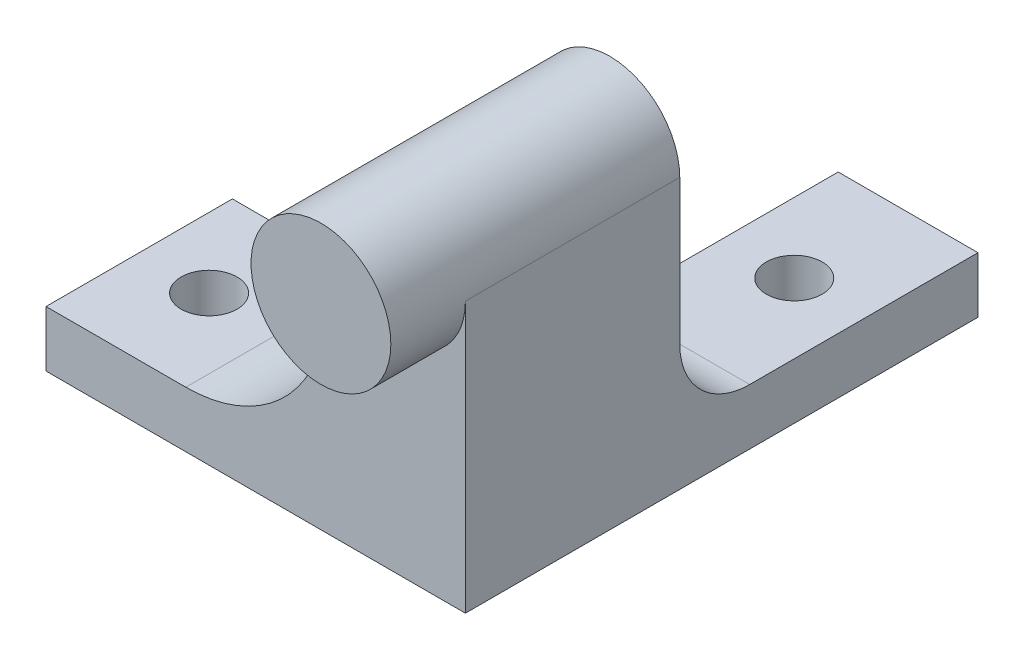
from build123d import *

# Parameters (mm, degrees)
BOSS_EXTRUDE1_DEPTH = 20
SKETCH3_R           = 7.5
BOSS_EXTRUDE3_DEPTH = 8
BOSS_EXTRUDE4_DEPTH = 15
BOSS_EXTRUDE5_START = 3
SKETCH5_R           = 7.5
BOSS_EXTRUDE5_DEPTH = 3
SKETCH6_R           = 3
CUT_EXTRUDE1_DEPTH  = 60.678304265


with BuildPart() as part:
    # Sketch1 → Boss-Extrude1 (new body)
    with BuildSketch(Plane.XY):
        with BuildLine():
            Line((-7.5, 0), (-7.5, -8))
            ThreePointArc((-7.5, -8), (-11.893398282, -18.606601718), (-22.5, -23))
            Line((-22.5, -23), (-37.5, -23))
            Line((-37.5, -23), (-37.5, -29))
            Line((-37.5, -29), (7.5, -29))
            Line((7.5, -29), (7.5, -23))
            Line((7.5, -23), (7.5, -8))
            Line((7.5, -8), (7.5, 0))
            ThreePointArc((7.5, 0), (0, 7.5), (-7.5, 0))
        make_face()
    extrude(amount=BOSS_EXTRUDE1_DEPTH)

    # Sketch3 → Boss-Extrude3 (add)
    with BuildSketch(Plane.XY.offset(20)):
        Circle(SKETCH3_R)
    extrude(amount=BOSS_EXTRUDE3_DEPTH)

    # Sketch4 → Boss-Extrude4 (add)
    with BuildSketch(Plane(origin=(7.5, 0, 0), x_dir=(0, 0, -1), z_dir=(1, 0, 0))):
        with BuildLine():
            Line((0, -29), (35, -29))
            Line((35, -29), (35, -23))
            Line((35, -23), (10.5, -23))
            ThreePointArc((10.5, -23), (5.196699141, -20.803300859), (3, -15.5))
            Line((3, -15.5), (3, 0))
            Line((3, 0), (0, 0))
            Line((0, 0), (0, -29))
        make_face()
    extrude(amount=-BOSS_EXTRUDE4_DEPTH)

    # Sketch5 → Boss-Extrude5 (add)
    with BuildSketch(Plane(origin=(0, 0, 0), x_dir=(-1, 0, 0), z_dir=(0, 0, -1)).offset(BOSS_EXTRUDE5_START)):
        with Locations(Location((0, 0, 0), (0, 0, 180))):
            Circle(SKETCH5_R)
    extrude(amount=-BOSS_EXTRUDE5_DEPTH)

    # Sketch6 → Cut-Extrude1 (cut, through all)
    with BuildSketch(Plane(origin=(0, -23, 0), x_dir=(1, 0, 0), z_dir=(0, 1, 0))):
        with Locations(Location((0, 22.783810394, 0), (0, 0, 270))):
            Circle(SKETCH6_R)
        with Locations(Location((-30, -10, 0), (0, 0, 270))):
            Circle(SKETCH6_R)
    extrude(amount=-CUT_EXTRUDE1_DEPTH, mode=Mode.SUBTRACT)


solid = part.part
